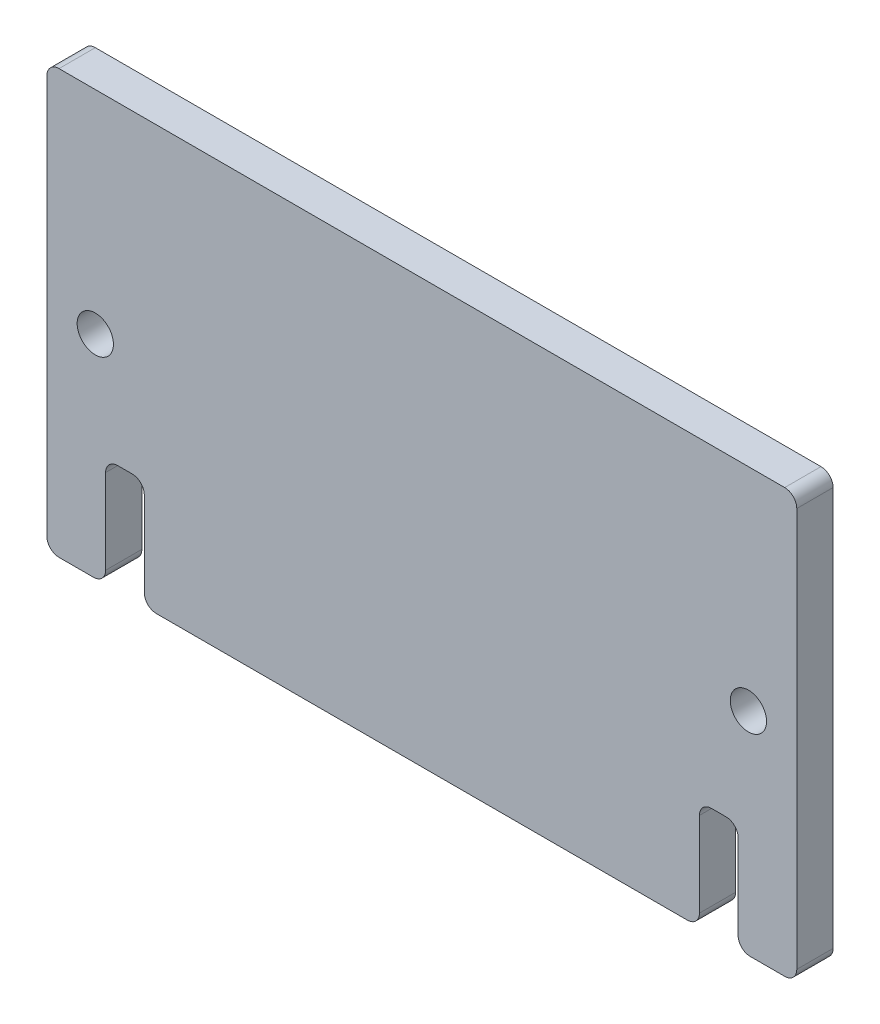
from build123d import *

# Parameters (mm, degrees)
SKETCH_1_R      = 1.5
EXTRUDE_1_DEPTH = 3
FILLET_1_R      = 1


with BuildPart() as part:
    # 草图1 → 凸台-拉伸1 (new body)
    with BuildSketch(Plane.XY):
        Polygon((-31, -17.5), (-26.15, -17.5), (-26.15, -8.5), (-22.95, -8.5), (-22.95, -17.5), (22.95, -17.5), (22.95, -8.5), (26.15, -8.5), (26.15, -17.5), (31, -17.5), (31, 17.5), (-31, 17.5), align=None)
        with Locations((-27, 0)):
            Circle(SKETCH_1_R, mode=Mode.SUBTRACT)
        with Locations((27, 0)):
            Circle(SKETCH_1_R, mode=Mode.SUBTRACT)
    extrude(amount=EXTRUDE_1_DEPTH)

    # 圆角1
    fillet_1_edges = [part.edges().sort_by_distance(p)[0] for p in [
        (31, -17.5, 1.5),
        (26.15, -17.5, 1.5),
        (26.15, -8.5, 1.5),
        (22.95, -8.5, 1.5),
        (22.95, -17.5, 1.5),
        (-22.95, -17.5, 1.5),
        (-22.95, -8.5, 1.5),
        (-26.15, -8.5, 1.5),
        (-26.15, -17.5, 1.5),
        (-31, -17.5, 1.5),
        (-31, 17.5, 1.5),
        (31, 17.5, 1.5),
    ]]
    fillet(fillet_1_edges, radius=FILLET_1_R)


solid = part.part
